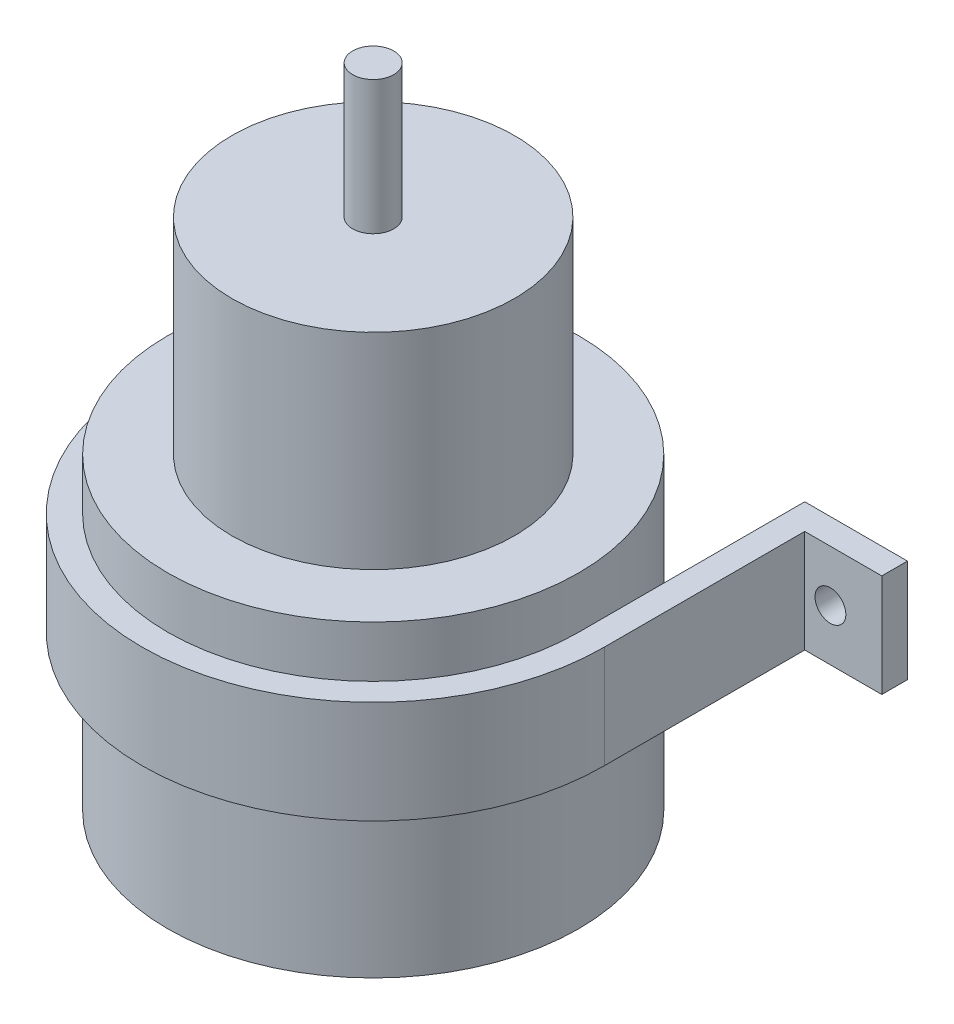
from build123d import *

# Parameters (mm, degrees)
SKETCH1_R           = 20
BOSS_EXTRUDE1_DEPTH = 30
SKETCH2_R           = 13.75
BOSS_EXTRUDE2_DEPTH = 20
SKETCH3_R           = 2
BOSS_EXTRUDE3_DEPTH = 13
EXTRUDE_THIN2_START = -10
EXTRUDE_THIN2_DEPTH = 10
SKETCH6_R           = 1.5
CUT_EXTRUDE1_DEPTH  = 10


with BuildPart() as part:
    # Sketch1 → Boss-Extrude1 (new body)
    with BuildSketch(Plane(origin=(0, 0, 0), x_dir=(1, 0, 0), z_dir=(0, 1, 0))):
        with Locations(Location((0, 0, 0), (0, 0, 270))):
            Circle(SKETCH1_R)
    extrude(amount=BOSS_EXTRUDE1_DEPTH)

    # Sketch2 → Boss-Extrude2 (add)
    with BuildSketch(Plane(origin=(0, 30, 0), x_dir=(1, 0, 0), z_dir=(0, 1, 0))):
        with Locations(Location((0, 0, 0), (0, 0, 270))):
            Circle(SKETCH2_R)
    extrude(amount=BOSS_EXTRUDE2_DEPTH)

    # Sketch3 → Boss-Extrude3 (add)
    with BuildSketch(Plane(origin=(0, 50, 0), x_dir=(1, 0, 0), z_dir=(0, 1, 0))):
        with Locations(Location((0, 0, 0), (0, 0, 270))):
            Circle(SKETCH3_R)
    extrude(amount=BOSS_EXTRUDE3_DEPTH)

    # Sketch4 → Extrude-Thin2 (add)
    with BuildSketch(Plane(origin=(0, 25, 0), x_dir=(1, 0, 0), z_dir=(0, 1, 0)).offset(EXTRUDE_THIN2_START)):
        with BuildLine():
            Line((30, 22), (20, 22))
            Line((20, 22), (20, 0))
            ThreePointArc((20, 0), (0, -20), (-20, 0))
            Line((-20, 0), (-20, 22))
            Line((-20, 22), (-30, 22))
            Line((-30, 22), (-30, 19.5))
            Line((-30, 19.5), (-22.5, 19.5))
            Line((-22.5, 19.5), (-22.5, 0))
            ThreePointArc((-22.5, 0), (0, -22.5), (22.5, 0))
            Line((22.5, 0), (22.5, 19.5))
            Line((22.5, 19.5), (30, 19.5))
            Line((30, 19.5), (30, 22))
        make_face()
    extrude(amount=EXTRUDE_THIN2_DEPTH)

    # Sketch6 → Cut-Extrude1 (cut)
    with BuildSketch(Plane(origin=(0, 0, -22), x_dir=(-1, 0, 0), z_dir=(0, 0, -1))):
        with Locations((-25, 20)):
            Circle(SKETCH6_R)
        with Locations(Location((25, 20, 0), (0, 0, 180))):
            Circle(SKETCH6_R)
    extrude(amount=-CUT_EXTRUDE1_DEPTH, mode=Mode.SUBTRACT)


solid = part.part
